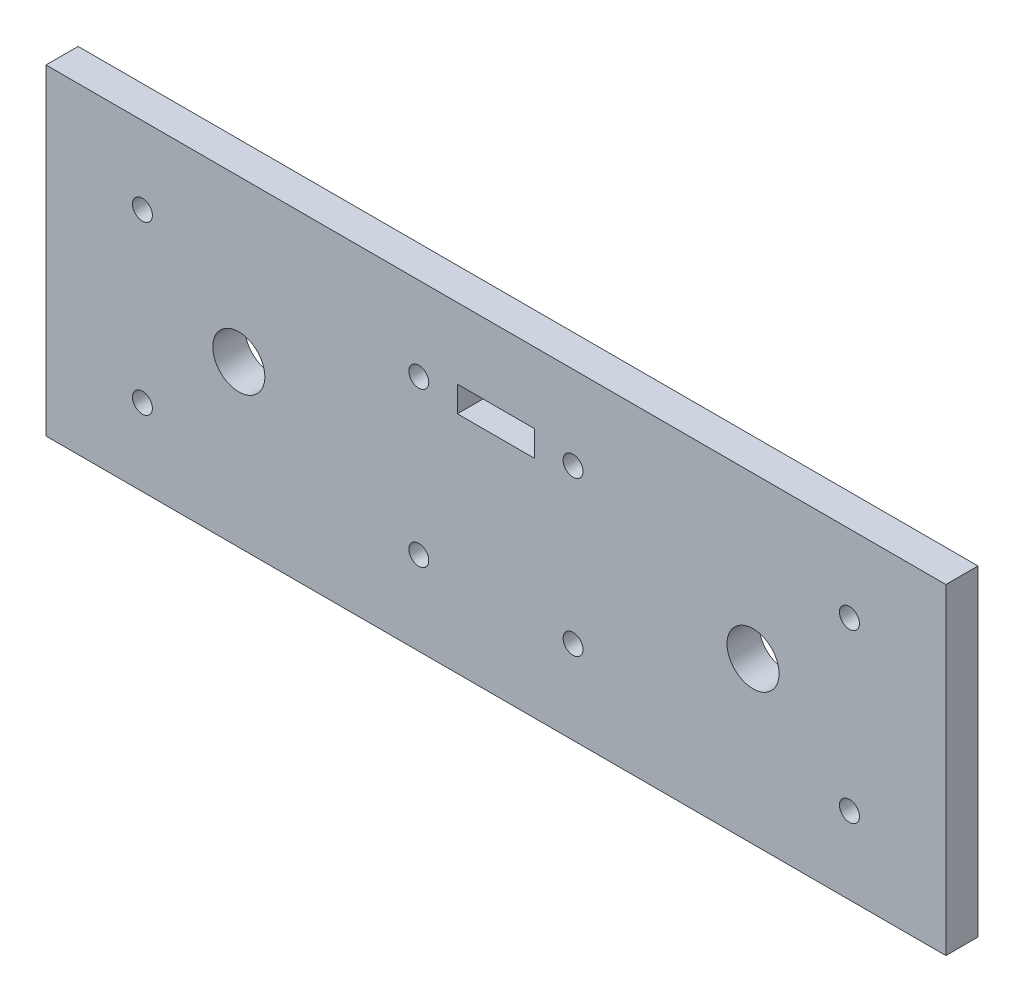
from build123d import *

# Parameters (mm, degrees)
ESQUISSE1_W        = 140
ESQUISSE1_H        = 50
ESQUISSE1_R        = 4.05
ESQUISSE1_R_2      = 1.55
ESQUISSE1_W_2      = 12
ESQUISSE1_H_2      = 4
BOSS_EXTRU_1_DEPTH = 5


with BuildPart() as part:
    # Esquisse1 → Boss.-Extru.1 (new body)
    with BuildSketch(Plane.XY):
        Rectangle(ESQUISSE1_W, ESQUISSE1_H)
        with Locations((-40, 0)):
            Circle(ESQUISSE1_R, mode=Mode.SUBTRACT)
        with Locations((-55, -13)):
            Circle(ESQUISSE1_R_2, mode=Mode.SUBTRACT)
        with Locations(Location((-55, 13, 0), (0, 0, 180))):
            Circle(ESQUISSE1_R_2, mode=Mode.SUBTRACT)
        with Locations(Location((55, -13, 0), (0, 0, 180))):
            Circle(ESQUISSE1_R_2, mode=Mode.SUBTRACT)
        with Locations((55, 13)):
            Circle(ESQUISSE1_R_2, mode=Mode.SUBTRACT)
        with Locations(Location((40, 0, 0), (0, 0, 180))):
            Circle(ESQUISSE1_R, mode=Mode.SUBTRACT)
        with Locations((-12, 12)):
            Circle(ESQUISSE1_R_2, mode=Mode.SUBTRACT)
        with Locations(Location((-12, -12, 0), (0, 0, 180))):
            Circle(ESQUISSE1_R_2, mode=Mode.SUBTRACT)
        with Locations((12, -12)):
            Circle(ESQUISSE1_R_2, mode=Mode.SUBTRACT)
        with Locations(Location((12, 12, 0), (0, 0, 180))):
            Circle(ESQUISSE1_R_2, mode=Mode.SUBTRACT)
        with Locations((0, 12)):
            Rectangle(ESQUISSE1_W_2, ESQUISSE1_H_2, mode=Mode.SUBTRACT)
    extrude(amount=-BOSS_EXTRU_1_DEPTH)


solid = part.part
